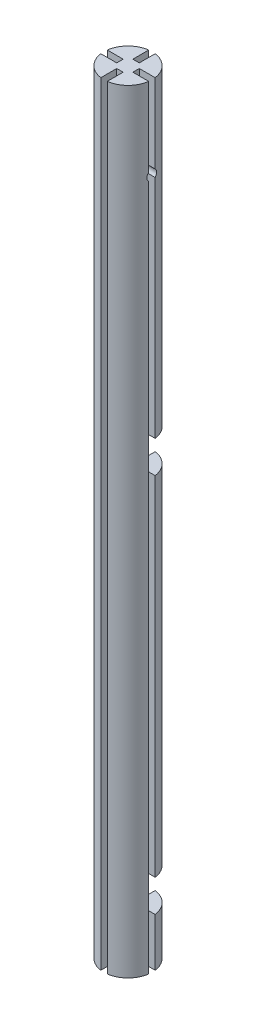
from build123d import *

# Parameters (mm, degrees)
BOSS_EXTRUDE2_DEPTH     = 4000
CUT_EXTRUDE1_START      = 200
SKETCH2_W               = 74.330343737
SKETCH2_H               = 74.330343737
CUT_EXTRUDE1_DEPTH      = 50
CUT_EXTRUDE2_START      = 1380
SKETCH2_2_W             = 74.330343737
SKETCH2_2_H             = 74.330343737
CUT_EXTRUDE2_DEPTH      = 50
SKETCH3_R               = 15.2
CUT_EXTRUDE3_DEPTH      = 49.330343737
SKETCH4_R               = 15.2
CUT_EXTRUDE4_DEPTH      = 49.330343737
CUT_EXTRUDE5_DEPTH      = 4002.923477282
CUT_EXTRUDE5_DEPTH_BACK = 4002.923477282
SKETCH5_W               = 148.660687474
SKETCH5_H               = 1600


with BuildPart() as part:
    # Sketch1 → Boss-Extrude2 (new body)
    with BuildSketch(Plane(origin=(0, 0, 0), x_dir=(1, 0, 0), z_dir=(0, 1, 0))):
        with BuildLine():
            Line((-10, 74.330343737), (-10, 25))
            Line((-10, 25), (10, 25))
            Line((10, 25), (10, 74.330343737))
            ThreePointArc((10, 74.330343737), (53.033008589, 53.033008589), (74.330343737, 10))
            Line((74.330343737, 10), (25, 10))
            Line((25, 10), (25, -10))
            Line((25, -10), (74.330343737, -10))
            ThreePointArc((74.330343737, -10), (53.033008589, -53.033008589), (10, -74.330343737))
            Line((10, -74.330343737), (10, -25))
            Line((10, -25), (-10, -25))
            Line((-10, -25), (-10, -74.330343737))
            ThreePointArc((-10, -74.330343737), (-53.033008589, -53.033008589), (-74.330343737, -10))
            Line((-74.330343737, -10), (-25, -10))
            Line((-25, -10), (-25, 10))
            Line((-25, 10), (-74.330343737, 10))
            ThreePointArc((-74.330343737, 10), (-53.033008589, 53.033008589), (-10, 74.330343737))
        make_face()
    extrude(amount=BOSS_EXTRUDE2_DEPTH)

    # Sketch2 → Cut-Extrude1 (cut, symmetric)
    with BuildSketch(Plane(origin=(0, 0, 0), x_dir=(1, 0, 0), z_dir=(0, 1, 0)).offset(CUT_EXTRUDE1_START)):
        with Locations((37.165171869, 37.165171869)):
            Rectangle(SKETCH2_W, SKETCH2_H)
    extrude(amount=CUT_EXTRUDE1_DEPTH, both=True, mode=Mode.SUBTRACT)

    # Sketch2<2> → Cut-Extrude2 (cut, symmetric)
    with BuildSketch(Plane(origin=(0, 0, 0), x_dir=(1, 0, 0), z_dir=(0, 1, 0)).offset(CUT_EXTRUDE2_START)):
        with Locations((37.165171869, 37.165171869)):
            Rectangle(SKETCH2_2_W, SKETCH2_2_H)
    extrude(amount=CUT_EXTRUDE2_DEPTH, both=True, mode=Mode.SUBTRACT)

    # Sketch3 → Cut-Extrude3 (cut)
    with BuildSketch(Plane(origin=(74.330343737, 0, 0), x_dir=(0, 0, -1), z_dir=(1, 0, 0))):
        with Locations((0, 2143)):
            Circle(SKETCH3_R)
    extrude(amount=-CUT_EXTRUDE3_DEPTH, mode=Mode.SUBTRACT)

    # Sketch4 → Cut-Extrude4 (cut)
    with BuildSketch(Plane(origin=(0, 0, -74.330343737), x_dir=(-1, 0, 0), z_dir=(0, 0, -1))):
        with Locations((0, 2143)):
            Circle(SKETCH4_R)
    extrude(amount=-CUT_EXTRUDE4_DEPTH, mode=Mode.SUBTRACT)

    # Sketch5 → Cut-Extrude5 (cut, two sides: drawn at the far end of the back side and taken through both)
    with BuildSketch(Plane.XY.offset(25).offset(-CUT_EXTRUDE5_DEPTH_BACK)):
        with Locations((0, 3200)):
            Rectangle(SKETCH5_W, SKETCH5_H)
    extrude(amount=CUT_EXTRUDE5_DEPTH + CUT_EXTRUDE5_DEPTH_BACK, mode=Mode.SUBTRACT)


solid = part.part
